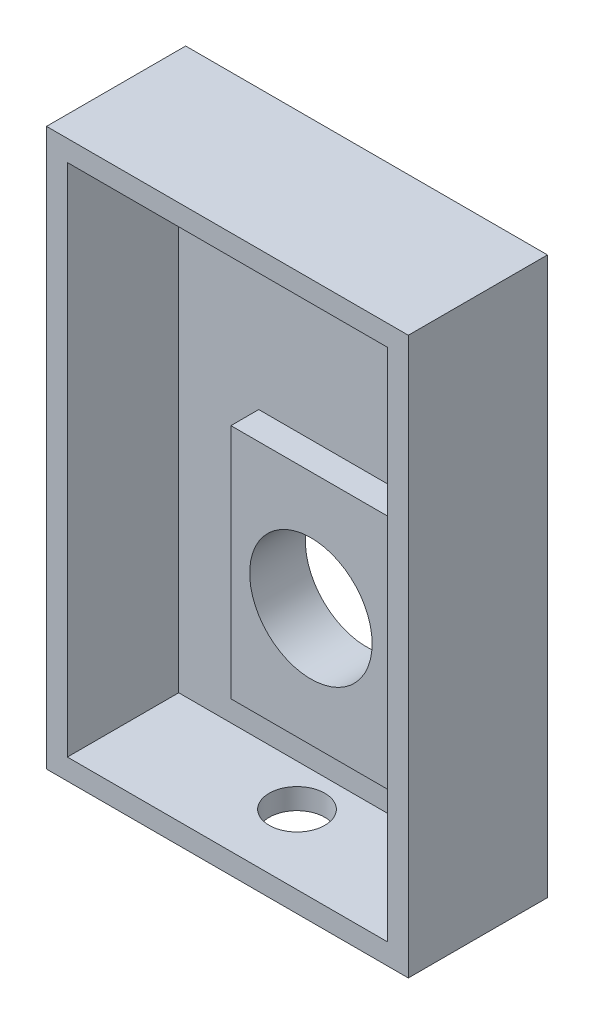
from build123d import *

# Parameters (mm, degrees)
SKETCH1_W           = 26
SKETCH1_H           = 40
SKETCH1_R           = 4.4
BOSS_EXTRUDE1_DEPTH = 2
SKETCH2_W           = 11.5
SKETCH2_H           = 17
SKETCH2_R           = 4.4
BOSS_EXTRUDE2_DEPTH = 2
SKETCH3_W           = 26
SKETCH3_H           = 40
SKETCH3_W_2         = 23
SKETCH3_H_2         = 37
BOSS_EXTRUDE3_DEPTH = 8
SKETCH4_R           = 2
CUT_EXTRUDE1_DEPTH  = 2


with BuildPart() as part:
    # Sketch1 → Boss-Extrude1 (new body)
    with BuildSketch(Plane.XY):
        with Locations((13, -20)):
            Rectangle(SKETCH1_W, SKETCH1_H)
        with Locations((13, -26.5)):
            Circle(SKETCH1_R, mode=Mode.SUBTRACT)
    extrude(amount=BOSS_EXTRUDE1_DEPTH)

    # Sketch2 → Boss-Extrude2 (add)
    with BuildSketch(Plane.XY.offset(2)):
        with Locations((13, -26.5)):
            Rectangle(SKETCH2_W, SKETCH2_H)
        with Locations((13, -26.5)):
            Circle(SKETCH2_R, mode=Mode.SUBTRACT)
    extrude(amount=BOSS_EXTRUDE2_DEPTH)

    # Sketch3 → Boss-Extrude3 (add)
    with BuildSketch(Plane.XY.offset(2)):
        with Locations((13, -20)):
            Rectangle(SKETCH3_W, SKETCH3_H)
        with Locations((13, -20)):
            Rectangle(SKETCH3_W_2, SKETCH3_H_2, mode=Mode.SUBTRACT)
    extrude(amount=BOSS_EXTRUDE3_DEPTH)

    # Sketch4 → Cut-Extrude1 (cut)
    with BuildSketch(Plane.XZ.offset(40)):
        with Locations(Location((13, 5, 0), (0, 0, 270))):
            Circle(SKETCH4_R)
    extrude(amount=-CUT_EXTRUDE1_DEPTH, mode=Mode.SUBTRACT)


solid = part.part
